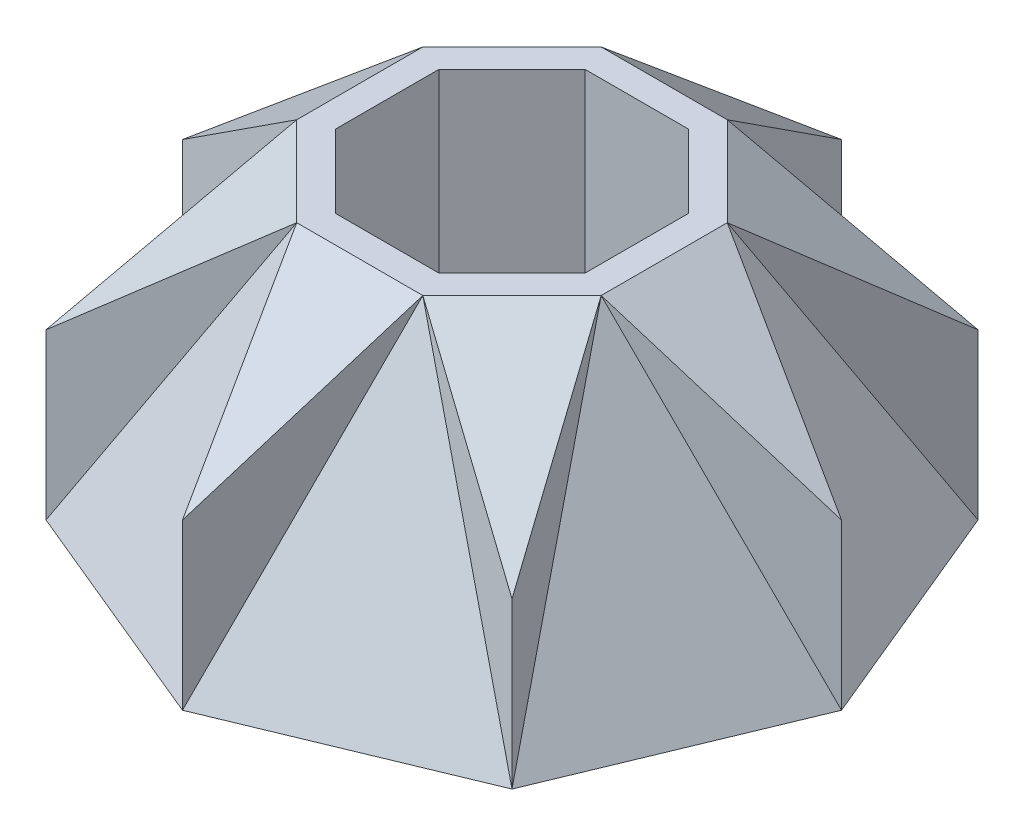
from build123d import *

# Parameters (mm, degrees)
EXTRUDE_1_REACH          = 103.119
CUT_EXTRUDE_2_DEPTH      = 102.118742254
PATTERN_CIRCULAR_2_COUNT = 8
CUT_EXTRUDE_3_DEPTH      = 102.118742254


with BuildPart() as part:
    # 草图7 → 放样4 section 0
    with BuildSketch(Plane(origin=(0, 55, 0), x_dir=(1, 0, 0), z_dir=(0, 1, 0))):
        with BuildLine():
            Line((0, 32.471766009), (-22.961005942, 22.961005942))
            Line((-22.961005942, 22.961005942), (-32.471766009, 0))
            Line((-32.471766009, 0), (-22.961005942, -22.961005942))
            Line((-22.961005942, -22.961005942), (0, -32.471766009))
            Line((0, -32.471766009), (22.961005942, -22.961005942))
            Line((22.961005942, -22.961005942), (32.471766009, 0))
            Line((32.471766009, 0), (22.961005942, 22.961005942))
            Line((22.961005942, 22.961005942), (0, 32.471766009))
        make_face()
    # 草图1 → 放样4 section 1
    with BuildSketch(Plane(origin=(0, 0, 0), x_dir=(1, 0, 0), z_dir=(0, 1, 0))):
        with BuildLine():
            Line((0, 60), (-42.426406871, 42.426406871))
            Line((-42.426406871, 42.426406871), (-60, 0))
            Line((-60, 0), (-42.426406871, -42.426406871))
            Line((-42.426406871, -42.426406871), (0, -60))
            Line((0, -60), (42.426406871, -42.426406871))
            Line((42.426406871, -42.426406871), (60, 0))
            Line((60, 0), (42.426406871, 42.426406871))
            Line((42.426406871, 42.426406871), (0, 60))
        make_face()
    loft()

    # 草图9 → 凸台-拉伸1 (add, up to next)
    with BuildSketch(Plane(origin=(0, 55, 0), x_dir=(1, 0, 0), z_dir=(0, 1, 0)), mode=Mode.PRIVATE) as extrude_1_sk1:
        Polygon((27.716385975, 11.480502971), (60, 0), (27.716385975, -11.480502971), align=None)
    extrude_1_tool1 = extrude(extrude_1_sk1.sketch, amount=-EXTRUDE_1_REACH, mode=Mode.PRIVATE) - part.part
    extrude_1 = extrude_1_tool1.solids().sort_by_distance((38.477591, 55, 0))[0]
    add(extrude_1)

    # 草图10 → 切除-拉伸2 (cut, symmetric)
    with BuildSketch(Plane.XY):
        Polygon((-175.786069036, 212.589586203), (27.716385975, 55), (60, 30), (263.502455012, -127.589586203), (578.681627419, 279.41532382), (139.39310337, 619.594496227), align=None)
    cut_extrude_2 = extrude(amount=CUT_EXTRUDE_2_DEPTH, both=True, mode=Mode.SUBTRACT)

    # 阵列(圆周)2: 凸台-拉伸1, 切除-拉伸2 ×8 about axis
    pattern_circular_2_axis = Axis((0, 58.101798211, 0), (0, -1, 0))
    add([extrude_1.rotate(pattern_circular_2_axis, i * 360 / PATTERN_CIRCULAR_2_COUNT) for i in range(1, PATTERN_CIRCULAR_2_COUNT)])
    add([cut_extrude_2.rotate(pattern_circular_2_axis, i * 360 / PATTERN_CIRCULAR_2_COUNT) for i in range(1, PATTERN_CIRCULAR_2_COUNT)], mode=Mode.SUBTRACT)

    # 草图12 → 切除-拉伸3 (cut, through all)
    with BuildSketch(Plane(origin=(0, 55, 0), x_dir=(1, 0, 0), z_dir=(0, 1, 0))):
        Polygon((22.716385975, -9.409435159), (22.716385975, 9.409435159), (9.409435159, 22.716385975), (-9.409435159, 22.716385975), (-22.716385975, 9.409435159), (-22.716385975, -9.409435159), (-9.409435159, -22.716385975), (9.409435159, -22.716385975), align=None)
    extrude(amount=-CUT_EXTRUDE_3_DEPTH, mode=Mode.SUBTRACT)


solid = part.part
